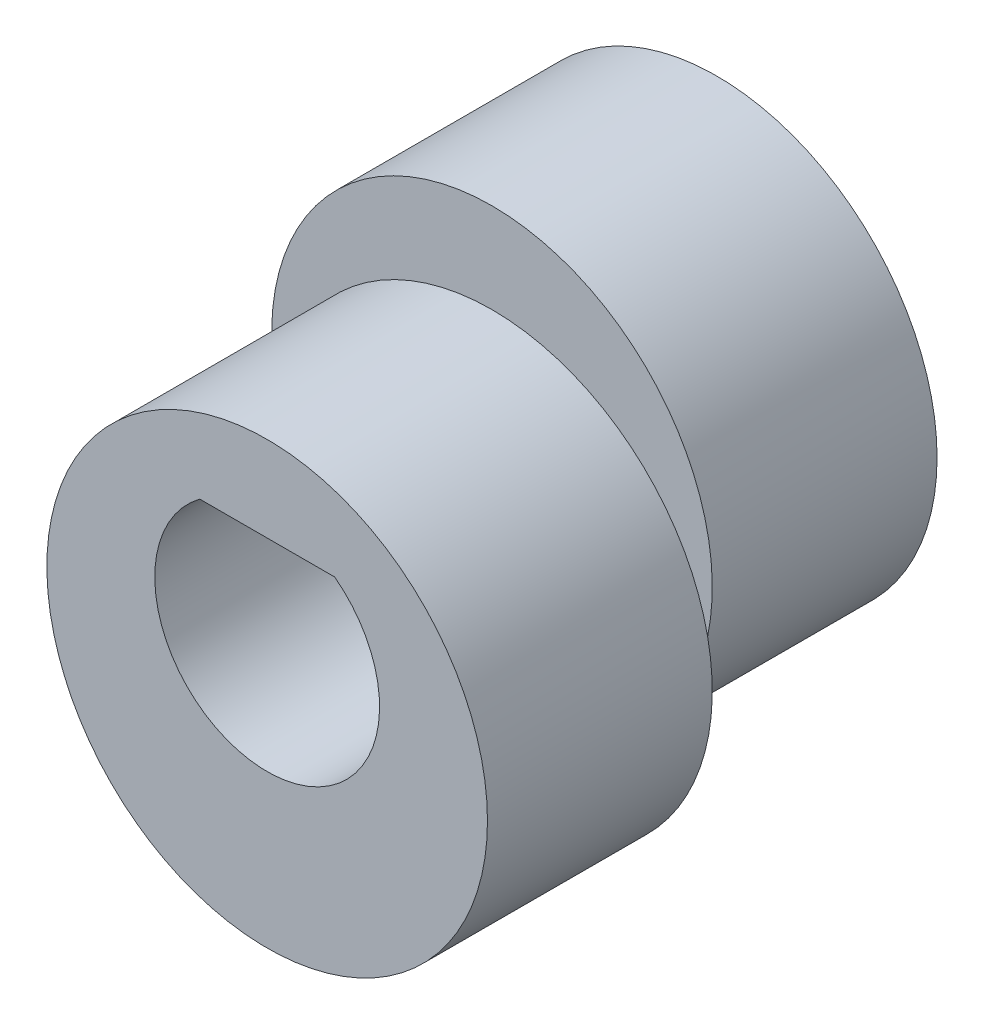
from build123d import *

# Parameters (mm, degrees)
ESQUISSE1_R        = 4.9
BOSS_EXTRU_1_DEPTH = 5
ESQUISSE2_R        = 4.9
BOSS_EXTRU_2_DEPTH = 5


with BuildPart() as part:
    # Esquisse1 → Boss.-Extru.1 (new body)
    with BuildSketch(Plane.XY):
        with Locations((0, 1)):
            Circle(ESQUISSE1_R)
        with BuildLine():
            Line((-1.5, 2), (1.5, 2))
            ThreePointArc((1.5, 2), (0, -2.5), (-1.5, 2))
        make_face(mode=Mode.SUBTRACT)
    extrude(amount=BOSS_EXTRU_1_DEPTH)

    # Esquisse2 → Boss.-Extru.2 (add)
    with BuildSketch(Plane.XY.offset(5)):
        with Locations(Location((0, -1, 0), (0, 0, 168.224256014))):
            Circle(ESQUISSE2_R)
        with BuildLine():
            Line((-1.5, 2), (1.5, 2))
            ThreePointArc((1.5, 2), (0, -2.5), (-1.5, 2))
        make_face(mode=Mode.SUBTRACT)
    extrude(amount=BOSS_EXTRU_2_DEPTH)


solid = part.part
